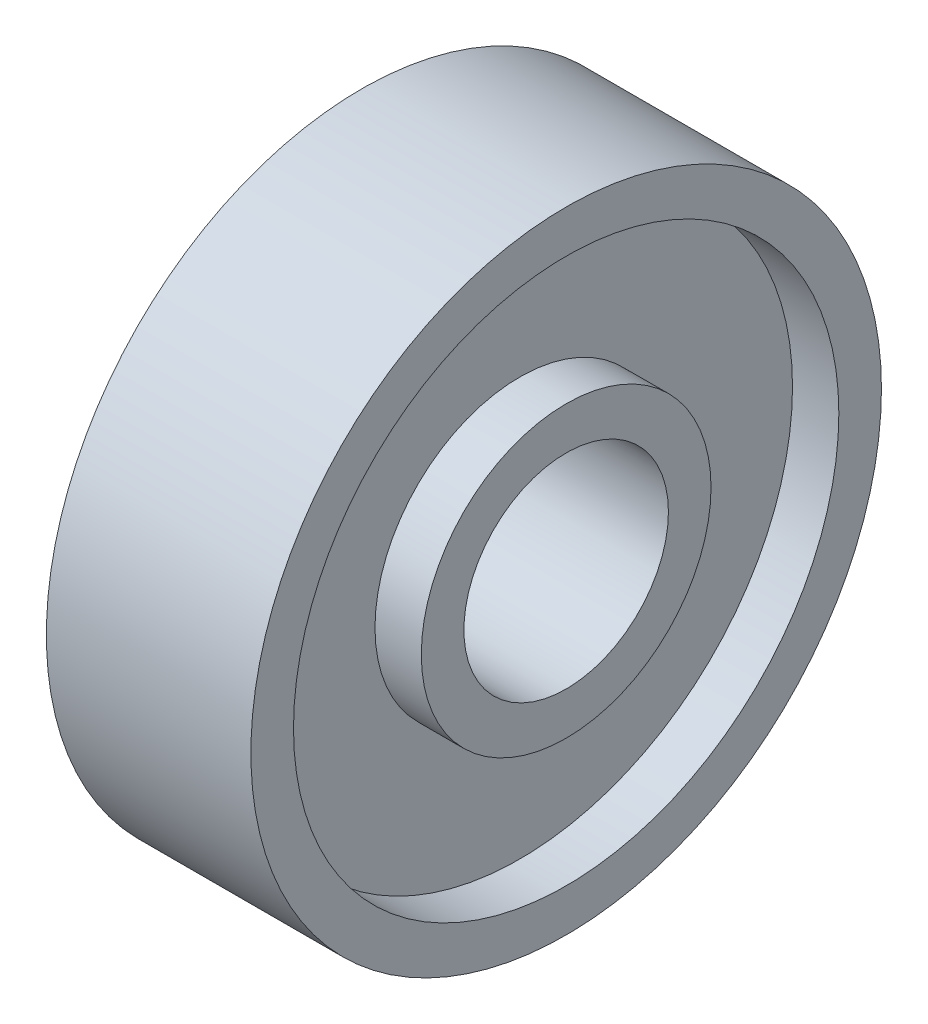
from build123d import *

# Parameters (mm, degrees)
SKETCH1_R           = 18.5
SKETCH1_R_2         = 6
BOSS_EXTRUDE1_DEPTH = 6
SKETCH2_W           = 5.43768574
SKETCH2_H           = 7.5


with BuildPart() as part:
    # Sketch1 → Boss-Extrude1 (new, symmetric)
    with BuildSketch(Plane(origin=(0, 0, 0), x_dir=(0, 0, -1), z_dir=(1, 0, 0))):
        Circle(SKETCH1_R)
        Circle(SKETCH1_R_2, mode=Mode.SUBTRACT)
    extrude(amount=BOSS_EXTRUDE1_DEPTH, both=True)

    # Sketch2 → Cut-Revolve1 (revolve, cut)
    with BuildSketch(Plane.XY, mode=Mode.PRIVATE) as cut_revolve1_sk:
        with Locations((6, 12.25)):
            Rectangle(SKETCH2_W, SKETCH2_H)
        with Locations((-6, 12.25)):
            Rectangle(SKETCH2_W, SKETCH2_H)
    revolve(cut_revolve1_sk.sketch.rotate(Axis((0, 0, 0), (1, 0, 0)), 90), axis=Axis((0, 0, 0), (1, 0, 0)), mode=Mode.SUBTRACT)


solid = part.part
